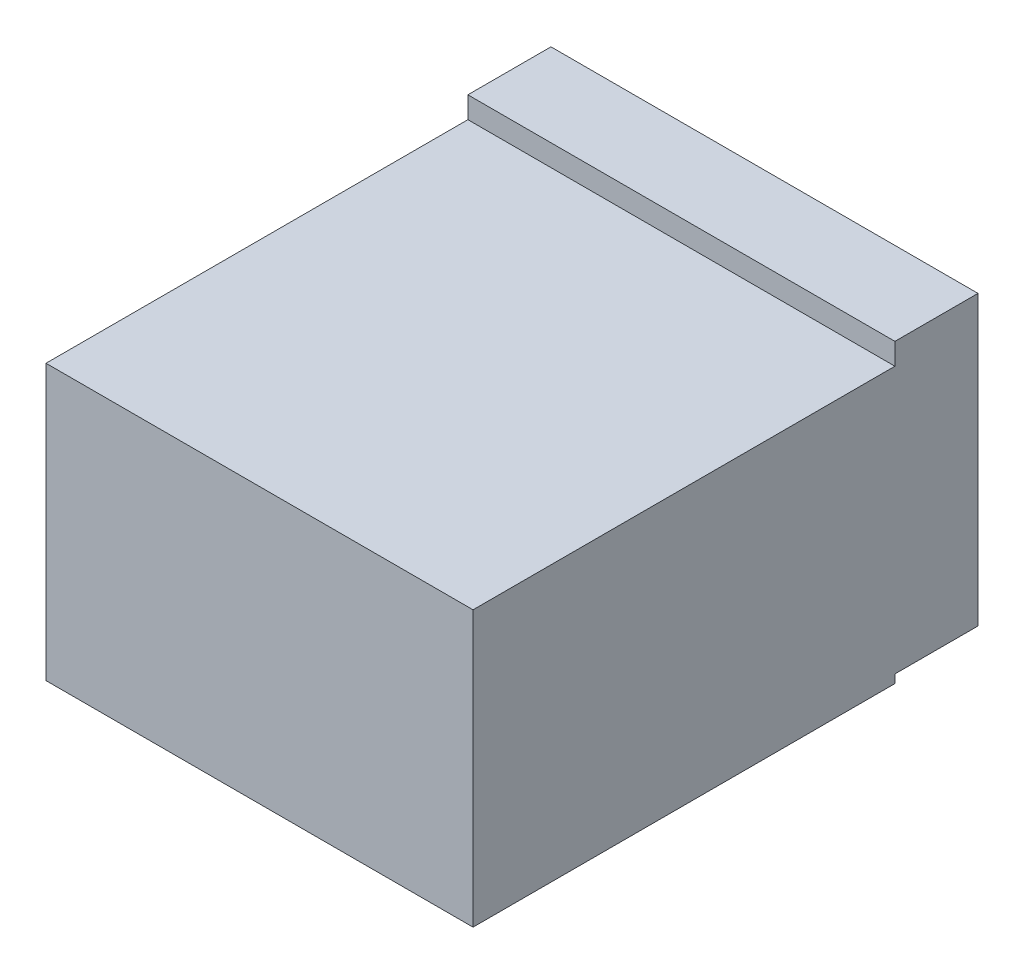
from build123d import *

# Parameters (mm, degrees)
SCROD_AND_CARRIERS_AND_HV_DEPTH      = 57.8026
SCROD_AND_CARRIERS_AND_HV_DEPTH_BACK = 13
SKETCH1_W                            = 110
SKETCH1_H                            = 108.6724
SKETCH2_W                            = 110
SKETCH2_H                            = 74.2
PMT_ASSEMBLY_DEPTH                   = 21.4016


with BuildPart() as part:
    # Sketch1 → SCROD-and-carriers-and-HV (new, two sides: drawn at the far end of the back side and taken through both)
    with BuildSketch(Plane(origin=(0, 0, 0), x_dir=(1, 0, 0), z_dir=(0, 1, 0)).offset(-SCROD_AND_CARRIERS_AND_HV_DEPTH_BACK)):
        with Locations((55, 39.3362)):
            Rectangle(SKETCH1_W, SKETCH1_H)
    extrude(amount=SCROD_AND_CARRIERS_AND_HV_DEPTH + SCROD_AND_CARRIERS_AND_HV_DEPTH_BACK)

    # Sketch2 → pmt-assembly (add)
    with BuildSketch(Plane(origin=(0, 0, -93.6724), x_dir=(-1, 0, 0), z_dir=(0, 0, -1))):
        with Locations((-55, 26.2526)):
            Rectangle(SKETCH2_W, SKETCH2_H)
    extrude(amount=PMT_ASSEMBLY_DEPTH)


solid = part.part
